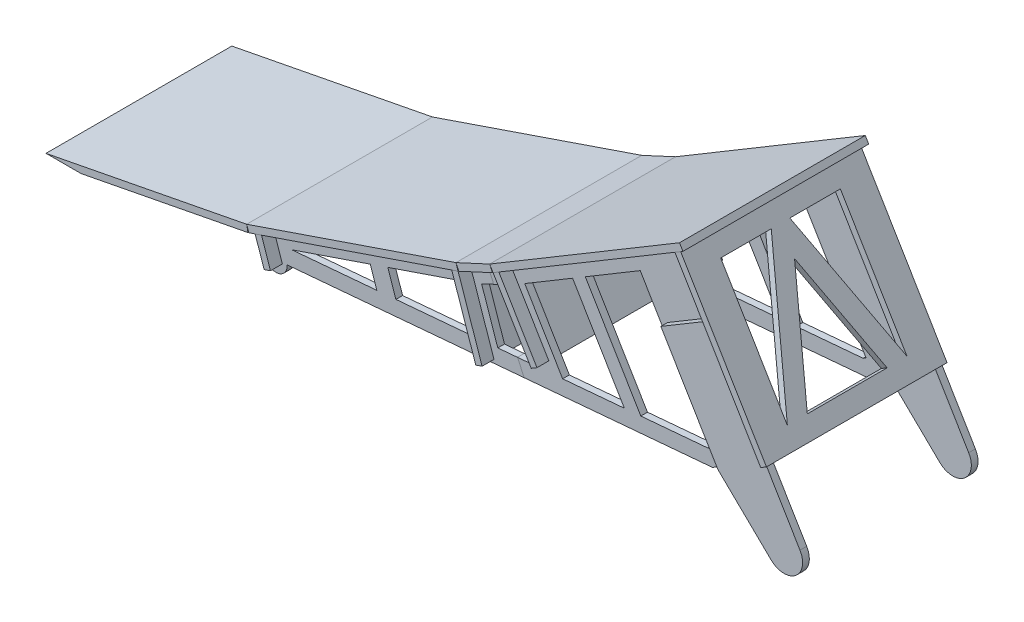
from build123d import *

# Parameters (mm, degrees)
BOSS_EXTRUDE1_DEPTH     = 250
BOSS_EXTRUDE1_2_DEPTH   = 250
BOSS_EXTRUDE1_3_DEPTH   = 250
BOSS_EXTRUDE1_4_DEPTH   = 250
BOSS_EXTRUDE2_START     = 200
BOSS_EXTRUDE2_DEPTH     = 18
BOSS_EXTRUDE8_START     = 218
BOSS_EXTRUDE8_DEPTH     = 18
BOSS_EXTRUDE3_DEPTH     = 18
SKETCH10_W              = 486
SKETCH10_H              = 450
BOSS_EXTRUDE4_DEPTH     = 18
SKETCH18_W              = 500
SKETCH18_H              = 200
BOSS_EXTRUDE9_DEPTH     = 18
SKETCH19_W              = 500
SKETCH19_H              = 200
BOSS_EXTRUDE10_DEPTH    = 18
SKETCH20_W              = 500
SKETCH20_H              = 75
BOSS_EXTRUDE11_DEPTH    = 18
CUT_EXTRUDE2_DEPTH      = 18
CUT_EXTRUDE3_DEPTH      = 2174.010915016
CUT_EXTRUDE3_DEPTH_BACK = 2174.010915016


with BuildPart() as part:
    # Sketch6 → Boss-Extrude1 (new, symmetric)
    with BuildSketch(Plane.XY):
        Polygon((94.53452545, 0), (0, 0), (539.937920842, 104.723644117), (543.365240104, 87.052948526), align=None)
    extrude(amount=BOSS_EXTRUDE1_DEPTH, both=True)


with BuildPart() as body_2:
    # Sketch6 → Boss-Extrude1 2 (new, symmetric)
    with BuildSketch(Plane.XY):
        Polygon((1103.053289344, 296.885247349), (1108.866581543, 279.849824436), (545.75121304, 87.688221205), (539.937920842, 104.723644117), align=None)
    extrude(amount=BOSS_EXTRUDE1_2_DEPTH, both=True)


with BuildPart() as body_3:
    # Sketch6 → Boss-Extrude1 3 (new, symmetric)
    with BuildSketch(Plane.XY):
        Polygon((1193.800214808, 338.897097092), (1201.362347762, 322.562650509), (1110.615422298, 280.550800765), (1103.053289344, 296.885247349), align=None)
    extrude(amount=BOSS_EXTRUDE1_3_DEPTH, both=True)


with BuildPart() as body_4:
    # Sketch6 → Boss-Extrude1 4 (new, symmetric)
    with BuildSketch(Plane.XY):
        Polygon((1704.657517606, 643.937776637), (1713.885639004, 628.483269998), (1203.028336206, 323.442590453), (1193.800214808, 338.897097092), align=None)
    extrude(amount=BOSS_EXTRUDE1_4_DEPTH, both=True)


with BuildPart() as body_5:
    # Sketch8 → Boss-Extrude2 (new body)
    with BuildSketch(Plane.XY.offset(BOSS_EXTRUDE2_START)):
        Polygon((1692.42104645, 615.666434723), (1202.218399833, 322.958965104), (1155.98888503, 301.556725637), (1254.655454355, 88.433812293), (1761.463497139, 132.773770621), (1923.1240814, 229.303768741), align=None)
    extrude(amount=BOSS_EXTRUDE2_DEPTH)


with BuildPart() as body_6:
    # Sketch17 → Boss-Extrude8 (new body)
    with BuildSketch(Plane.XY.offset(BOSS_EXTRUDE8_START)):
        with BuildLine():
            Line((1254.655454355, 88.433812293), (1155.98888503, 301.556725637))
            Line((1155.98888503, 301.556725637), (1109.759370227, 280.15448617))
            Line((1109.759370227, 280.15448617), (545.916310922, 87.744560412))
            ThreePointArc((545.916310922, 87.744560412), (540.170094701, 82.688905865), (539.681793859, 75.050829795))
            Line((539.681793859, 75.050829795), (558.36155207, 20.311179669))
            ThreePointArc((558.36155207, 20.311179669), (592.950825668, 0.647003481), (616.639764534, 32.614672282))
            Line((616.639764534, 32.614672282), (1254.655454355, 88.433812293))
        make_face()
    extrude(amount=-BOSS_EXTRUDE8_DEPTH)


with BuildPart() as body_7:
    # Sketch9 → Boss-Extrude3 (new body)
    with BuildSketch(Plane.XY.offset(218)):
        with BuildLine():
            Line((1769.3220581, 486.878879395), (1640.534502772, 409.977867745))
            Line((1640.534502772, 409.977867745), (1793.80385908, 153.294824416))
            Line((1793.80385908, 153.294824416), (1937.121726961, 14.128884896))
            ThreePointArc((1937.121726961, 14.128884896), (2002.971407437, 10.78394543), (2014.882838534, 75.63367055))
            Line((2014.882838534, 75.63367055), (1769.3220581, 486.878879395))
        make_face()
    extrude(amount=BOSS_EXTRUDE3_DEPTH)


with BuildPart() as body_8:
    # Mirror1: mirrored copy
    add(body_7.part.mirror(Plane.XY))


with BuildPart() as body_9:
    # Mirror1 2: mirrored copy
    add(body_5.part.mirror(Plane.XY))


with BuildPart() as body_10:
    # Mirror1 3: mirrored copy
    add(body_6.part.mirror(Plane.XY))


with BuildPart() as body_11:
    # Sketch10 → Boss-Extrude4 (new body)
    with BuildSketch(Plane(origin=(1518.594971798, 906.776196822, 0), x_dir=(0, 0, -1), z_dir=(0.8585837021828359, 0.5126734109996494, 0))):
        with Locations((-7, -564.058103897)):
            Rectangle(SKETCH10_W, SKETCH10_H)
    extrude(amount=BOSS_EXTRUDE4_DEPTH)

    # Sketch21 → Cut-Extrude2 (cut)
    with BuildSketch(Plane(origin=(1534.049478437, 916.00431822, 0), x_dir=(0, 0, -1), z_dir=(0.858583702182836, 0.5126734109996494, 0))):
        Polygon((-168, -389.058103897), (-32, -389.058103897), (-168, -739.058103897), align=None)
        Polygon((154, -739.058103897), (154, -389.058103897), (18, -389.058103897), align=None)
        Polygon((-114.357951309, -739.058103897), (100.357951309, -739.058103897), (-7, -462.769258616), align=None)
    extrude(amount=-CUT_EXTRUDE2_DEPTH, mode=Mode.SUBTRACT)


with BuildPart() as body_12:
    # Sketch18 → Boss-Extrude9 (new body)
    with BuildSketch(Plane(origin=(1044.656768193, 623.78047395, 0), x_dir=(0, 0, 1), z_dir=(-0.8585837021828362, -0.5126734109996488, 0))):
        with Locations((0, -439.058103897)):
            Rectangle(SKETCH18_W, SKETCH18_H)
    extrude(amount=BOSS_EXTRUDE9_DEPTH)


with BuildPart() as body_13:
    # Sketch19 → Boss-Extrude10 (new body)
    with BuildSketch(Plane(origin=(1078.745019921, 368.11883337, 0), x_dir=(0, 0, -1), z_dir=(0.9464123840375391, 0.3229606776999047, 0))):
        with Locations((0, -193.266963137)):
            Rectangle(SKETCH19_W, SKETCH19_H)
    extrude(amount=-BOSS_EXTRUDE10_DEPTH)


with BuildPart() as body_14:
    # Sketch20 → Boss-Extrude11 (new body)
    with BuildSketch(Plane(origin=(532.665074331, 181.770522337, 0), x_dir=(0, 0, 1), z_dir=(-0.946412384037533, -0.32296067769992237, 0))):
        with Locations((0, -130.766963137)):
            Rectangle(SKETCH20_W, SKETCH20_H)
    extrude(amount=-BOSS_EXTRUDE11_DEPTH)


with BuildPart() as cut_extrude3_tool:
    # Sketch22 → Cut-Extrude3 (new, two sides: drawn at the far end of the back side and taken through both)
    with BuildSketch(Plane.XY.offset(218).offset(-CUT_EXTRUDE3_DEPTH_BACK)):
        Polygon((840.470295916, 145.995440835), (858.245927781, 93.905266106), (629.067286371, 73.854733061), align=None)
        Polygon((887.790915118, 162.14347472), (909.545458676, 98.393393504), (1124.227091567, 117.175602649), (1085.821338057, 229.720823322), align=None)
        Polygon((1140.137545177, 250.139621594), (1183.734547405, 122.38183043), (1294.02874481, 132.031322356), (1205.449704677, 280.376289309), align=None)
        Polygon((1358.228032594, 137.648032243), (1524.260673415, 152.17400609), (1384.949008656, 385.481843634), (1256.161453329, 308.580831984), align=None)
        Polygon((1566.968753519, 494.168606766), (1419.292356743, 405.988780074), (1568.536044301, 156.047599116), (1748.835508068, 171.821758236), (1756.657915589, 176.492636958), align=None)
    extrude(amount=CUT_EXTRUDE3_DEPTH + CUT_EXTRUDE3_DEPTH_BACK)


with BuildPart() as body_5_1:
    add(body_5.part)

    # Cut-Extrude3: cut by cut_extrude3_tool
    add(cut_extrude3_tool.part, mode=Mode.SUBTRACT)


with BuildPart() as body_6_1:
    add(body_6.part)

    # Cut-Extrude3: cut by cut_extrude3_tool
    add(cut_extrude3_tool.part, mode=Mode.SUBTRACT)


with BuildPart() as body_9_1:
    add(body_9.part)

    # Cut-Extrude3: cut by cut_extrude3_tool
    add(cut_extrude3_tool.part, mode=Mode.SUBTRACT)


with BuildPart() as body_10_1:
    add(body_10.part)

    # Cut-Extrude3: cut by cut_extrude3_tool
    add(cut_extrude3_tool.part, mode=Mode.SUBTRACT)


solid = Compound([part.part, body_2.part, body_3.part, body_4.part, body_7.part, body_8.part, body_11.part, body_12.part, body_13.part, body_14.part, body_5_1.part, body_6_1.part, body_9_1.part, body_10_1.part])
